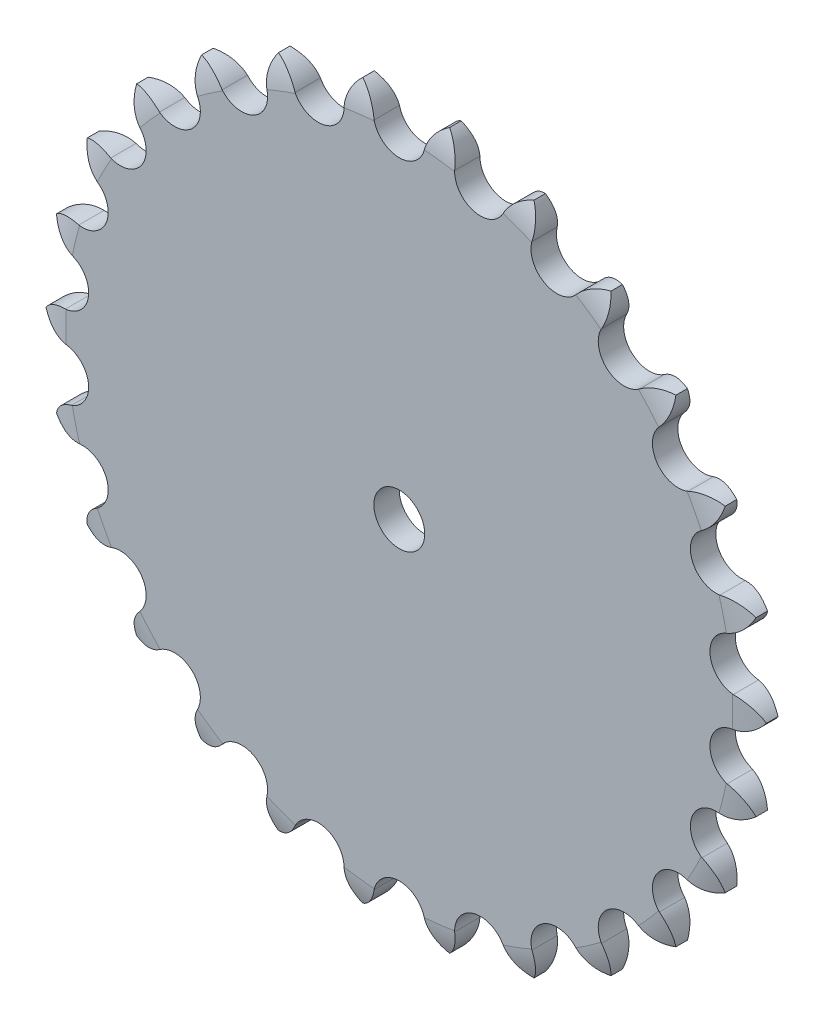
from build123d import *

# Parameters (mm, degrees)
SKETCH2_R           = 4
BOSS_EXTRUDE1_DEPTH = 4


with BuildPart() as part:
    # Sketch2 → Boss-Extrude1 (new body)
    with BuildSketch(Plane.XY):
        with BuildLine():
            ThreePointArc((3.964856262, 52.447805617), (0, 49.276), (-3.964856262, 52.447805617))
            ThreePointArc((-3.964856262, 52.447805617), (-4.989300963, 54.66856047), (-6.833064673, 56.275350576))
            ThreePointArc((-6.833064673, 56.275350576), (-8.23872192, 54.274009333), (-8.701936696, 51.872619916))
            ThreePointArc((-8.701936696, 51.872619916), (-11.792518673, 47.844128995), (-16.401226187, 49.974915495))
            ThreePointArc((-16.401226187, 49.974915495), (-17.927363809, 51.885973585), (-20.102081139, 53.004831753))
            ThreePointArc((-20.102081139, 53.004831753), (-20.987940231, 50.725250052), (-20.863004724, 48.282786095))
            ThreePointArc((-20.863004724, 48.282786095), (-22.899699026, 43.63173112), (-27.884416461, 44.597664937))
            ThreePointArc((-27.884416461, 44.597664937), (-29.823553434, 46.087962512), (-32.202837716, 46.653864773))
            ThreePointArc((-32.202837716, 46.653864773), (-32.517415745, 44.228523616), (-31.811590752, 41.886932246))
            ThreePointArc((-31.811590752, 41.886932246), (-32.676032107, 36.883615627), (-37.747065807, 36.628560198))
            ThreePointArc((-37.747065807, 36.628560198), (-39.986506538, 37.611486582), (-42.432082418, 37.591544753))
            ThreePointArc((-42.432082418, 37.591544753), (-42.157097251, 35.161396152), (-40.911402755, 33.056762149))
            ThreePointArc((-40.911402755, 33.056762149), (-40.553352976, 27.99195846), (-45.415992893, 26.53073668))
            ThreePointArc((-45.415992893, 26.53073668), (-47.825589226, 26.949167763), (-50.195328724, 26.344540791))
            ThreePointArc((-50.195328724, 26.344540791), (-49.346761499, 24.05081615), (-47.633592738, 22.305453192))
            ThreePointArc((-47.633592738, 22.305453192), (-46.073860375, 17.473510414), (-50.445507552, 14.891043181))
            ThreePointArc((-50.445507552, 14.891043181), (-52.885222508, 14.72066127), (-55.041404978, 13.566487877))
            ThreePointArc((-55.041404978, 13.566487877), (-53.668571338, 11.542490135), (-51.587491451, 10.257832372))
            ThreePointArc((-51.587491451, 10.257832372), (-48.91672248, 5.939565456), (-52.543312674, 2.385936379))
            ThreePointArc((-52.543312674, 2.385936379), (-54.871358888, 1.636643452), (-56.688674841, 0))
            ThreePointArc((-56.688674841, 0), (-54.871358888, -1.636643452), (-52.543312674, -2.385936379))
            ThreePointArc((-52.543312674, -2.385936379), (-48.91672248, -5.939565456), (-51.587491451, -10.257832372))
            ThreePointArc((-51.587491451, -10.257832372), (-53.668571338, -11.542490135), (-55.041404978, -13.566487877))
            ThreePointArc((-55.041404978, -13.566487877), (-52.885222508, -14.72066127), (-50.445507552, -14.891043181))
            ThreePointArc((-50.445507552, -14.891043181), (-46.073860375, -17.473510414), (-47.633592738, -22.305453192))
            ThreePointArc((-47.633592738, -22.305453192), (-49.346761499, -24.05081615), (-50.195328724, -26.344540791))
            ThreePointArc((-50.195328724, -26.344540791), (-47.825589226, -26.949167763), (-45.415992893, -26.53073668))
            ThreePointArc((-45.415992893, -26.53073668), (-40.553352976, -27.99195846), (-40.911402755, -33.056762149))
            ThreePointArc((-40.911402755, -33.056762149), (-42.157097251, -35.161396152), (-42.432082418, -37.591544753))
            ThreePointArc((-42.432082418, -37.591544753), (-39.986506538, -37.611486582), (-37.747065807, -36.628560198))
            ThreePointArc((-37.747065807, -36.628560198), (-32.676032107, -36.883615627), (-31.811590752, -41.886932246))
            ThreePointArc((-31.811590752, -41.886932246), (-32.517415745, -44.228523616), (-32.202837716, -46.653864773))
            ThreePointArc((-32.202837716, -46.653864773), (-29.823553434, -46.087962512), (-27.884416461, -44.597664937))
            ThreePointArc((-27.884416461, -44.597664937), (-22.899699026, -43.63173112), (-20.863004724, -48.282786095))
            ThreePointArc((-20.863004724, -48.282786095), (-20.987940231, -50.725250052), (-20.102081139, -53.004831753))
            ThreePointArc((-20.102081139, -53.004831753), (-17.927363809, -51.885973585), (-16.401226187, -49.974915495))
            ThreePointArc((-16.401226187, -49.974915495), (-11.792518673, -47.844128995), (-8.701936696, -51.872619916))
            ThreePointArc((-8.701936696, -51.872619916), (-8.23872192, -54.274009333), (-6.833064673, -56.275350576))
            ThreePointArc((-6.833064673, -56.275350576), (-4.989300963, -54.66856047), (-3.964856262, -52.447805617))
            ThreePointArc((-3.964856262, -52.447805617), (0, -49.276), (3.964856262, -52.447805617))
            ThreePointArc((3.964856262, -52.447805617), (4.989300963, -54.66856047), (6.833064673, -56.275350576))
            ThreePointArc((6.833064673, -56.275350576), (8.23872192, -54.274009333), (8.701936696, -51.872619916))
            ThreePointArc((8.701936696, -51.872619916), (11.792518673, -47.844128995), (16.401226187, -49.974915495))
            ThreePointArc((16.401226187, -49.974915495), (17.927363809, -51.885973585), (20.102081139, -53.004831753))
            ThreePointArc((20.102081139, -53.004831753), (20.987940231, -50.725250052), (20.863004724, -48.282786095))
            ThreePointArc((20.863004724, -48.282786095), (22.899699026, -43.63173112), (27.884416461, -44.597664937))
            ThreePointArc((27.884416461, -44.597664937), (29.823553434, -46.087962512), (32.202837716, -46.653864773))
            ThreePointArc((32.202837716, -46.653864773), (32.517415745, -44.228523616), (31.811590752, -41.886932246))
            ThreePointArc((31.811590752, -41.886932246), (32.676032107, -36.883615627), (37.747065807, -36.628560198))
            ThreePointArc((37.747065807, -36.628560198), (39.986506538, -37.611486582), (42.432082418, -37.591544753))
            ThreePointArc((42.432082418, -37.591544753), (42.157097251, -35.161396152), (40.911402755, -33.056762149))
            ThreePointArc((40.911402755, -33.056762149), (40.553352976, -27.99195846), (45.415992893, -26.53073668))
            ThreePointArc((45.415992893, -26.53073668), (47.825589226, -26.949167763), (50.195328724, -26.344540791))
            ThreePointArc((50.195328724, -26.344540791), (49.346761499, -24.05081615), (47.633592738, -22.305453192))
            ThreePointArc((47.633592738, -22.305453192), (46.073860375, -17.473510414), (50.445507552, -14.891043181))
            ThreePointArc((50.445507552, -14.891043181), (52.885222508, -14.72066127), (55.041404978, -13.566487877))
            ThreePointArc((55.041404978, -13.566487877), (53.668571338, -11.542490135), (51.587491451, -10.257832372))
            ThreePointArc((51.587491451, -10.257832372), (48.91672248, -5.939565456), (52.543312674, -2.385936379))
            ThreePointArc((52.543312674, -2.385936379), (54.871358888, -1.636643452), (56.688674841, 0))
            ThreePointArc((56.688674841, 0), (54.871358888, 1.636643452), (52.543312674, 2.385936379))
            ThreePointArc((52.543312674, 2.385936379), (48.91672248, 5.939565456), (51.587491451, 10.257832372))
            ThreePointArc((51.587491451, 10.257832372), (53.668571338, 11.542490135), (55.041404978, 13.566487877))
            ThreePointArc((55.041404978, 13.566487877), (52.885222508, 14.72066127), (50.445507552, 14.891043181))
            ThreePointArc((50.445507552, 14.891043181), (46.073860375, 17.473510414), (47.633592738, 22.305453192))
            ThreePointArc((47.633592738, 22.305453192), (49.346761499, 24.05081615), (50.195328724, 26.344540791))
            ThreePointArc((50.195328724, 26.344540791), (47.825589226, 26.949167763), (45.415992893, 26.53073668))
            ThreePointArc((45.415992893, 26.53073668), (40.553352976, 27.99195846), (40.911402755, 33.056762149))
            ThreePointArc((40.911402755, 33.056762149), (42.157097251, 35.161396152), (42.432082418, 37.591544753))
            ThreePointArc((42.432082418, 37.591544753), (39.986506538, 37.611486582), (37.747065807, 36.628560198))
            ThreePointArc((37.747065807, 36.628560198), (32.676032107, 36.883615627), (31.811590752, 41.886932246))
            ThreePointArc((31.811590752, 41.886932246), (32.517415745, 44.228523616), (32.202837716, 46.653864773))
            ThreePointArc((32.202837716, 46.653864773), (29.823553434, 46.087962512), (27.884416461, 44.597664937))
            ThreePointArc((27.884416461, 44.597664937), (22.899699026, 43.63173112), (20.863004724, 48.282786095))
            ThreePointArc((20.863004724, 48.282786095), (20.987940231, 50.725250052), (20.102081139, 53.004831753))
            ThreePointArc((20.102081139, 53.004831753), (17.927363809, 51.885973585), (16.401226187, 49.974915495))
            ThreePointArc((16.401226187, 49.974915495), (11.792518673, 47.844128995), (8.701936696, 51.872619916))
            ThreePointArc((8.701936696, 51.872619916), (8.23872192, 54.274009333), (6.833064673, 56.275350576))
            ThreePointArc((6.833064673, 56.275350576), (4.989300963, 54.66856047), (3.964856262, 52.447805617))
        make_face()
        Circle(SKETCH2_R, mode=Mode.SUBTRACT)
    extrude(amount=BOSS_EXTRUDE1_DEPTH)

    # Sketch7 → Cut-Revolve1 (revolve, cut)
    with BuildSketch(Plane(origin=(0, 0, 0), x_dir=(0, 0, -1), z_dir=(1, 0, 0))):
        with BuildLine():
            Line((-4, 50.419), (-7.774586271, 50.419))
            Line((-7.774586271, 50.419), (-7.774586271, 56.896))
            Line((-7.774586271, 56.896), (-2.808796476, 56.896))
            ThreePointArc((-2.808796476, 56.896), (-3.831535403, 53.736056013), (-4, 50.419))
        make_face()
        with BuildLine():
            Line((3.774586271, 56.896), (-1.191203524, 56.896))
            ThreePointArc((-1.191203524, 56.896), (-0.168464597, 53.736056013), (0, 50.419))
            Line((0, 50.419), (3.774586271, 50.419))
            Line((3.774586271, 50.419), (3.774586271, 56.896))
        make_face()
    revolve(axis=Axis((0, 0, 0), (0, 0, -1)), mode=Mode.SUBTRACT)


solid = part.part
